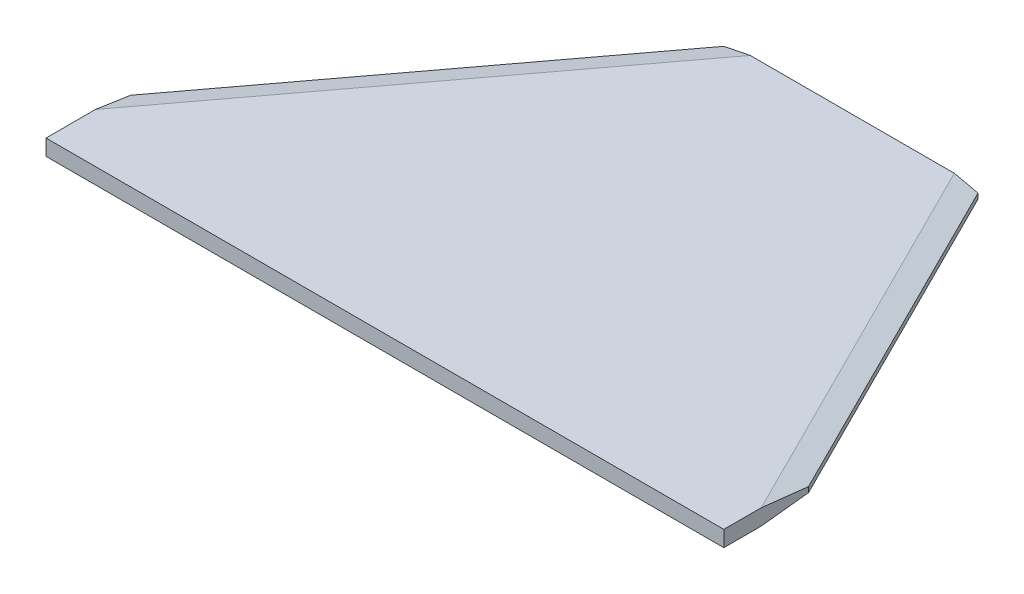
from build123d import *
from OCP.BRepFilletAPI import BRepFilletAPI_MakeChamfer

# Parameters (mm, degrees)
BOSS_EXTRUDE1_DEPTH      = 2.38125
BOSS_EXTRUDE1_DEPTH_BACK = 2.38125
CHAMFER1_SIZE            = 1.5875
CHAMFER1_SIZE2           = 6.35
CHAMFER3_SIZE            = 6.35
CHAMFER3_SIZE2           = 1.5875


with BuildPart() as part:
    # Sketch1 → Boss-Extrude1 (new, two sides: drawn at the far end of the back side and taken through both)
    with BuildSketch(Plane(origin=(0, 0, 0), x_dir=(1, 0, 0), z_dir=(0, 1, 0)).offset(-BOSS_EXTRUDE1_DEPTH_BACK)):
        Polygon((0, 0), (0, 25.4), (76.2, 127), (152.4, 127), (203.2, 25.4), (203.2, 0), align=None)
    extrude(amount=BOSS_EXTRUDE1_DEPTH + BOSS_EXTRUDE1_DEPTH_BACK)

    # Chamfer1: one chamfer whose edges measure the first distance from different faces: ONE call of the kernel's chamfer builder (chamfer() names one face for all edges)
    chamfer1_edges_1 = [part.edges().sort_by_distance(p)[0] for p in [
        (177.8, 2.38125, -76.2),
        (177.8, -2.38125, -76.2),
    ]]
    chamfer1_side_1 = [part.faces().sort_by_distance(p)[0] for p in [
        (177.8, 0, -76.2),
    ]]
    chamfer1_edges_2 = [part.edges().sort_by_distance(p)[0] for p in [
        (38.1, -2.38125, -76.2),
    ]]
    chamfer1_side_2 = [part.faces().sort_by_distance(p)[0] for p in [
        (38.1, 0, -76.2),
    ]]
    chamfer1 = BRepFilletAPI_MakeChamfer(part.part.solid().wrapped)
    for e in chamfer1_edges_1:
        chamfer1.Add(CHAMFER1_SIZE, CHAMFER1_SIZE2, e.wrapped, chamfer1_side_1[0].wrapped)  # the first distance lies on this face
    for e in chamfer1_edges_2:
        chamfer1.Add(CHAMFER1_SIZE, CHAMFER1_SIZE2, e.wrapped, chamfer1_side_2[0].wrapped)  # the first distance lies on this face
    add(Compound.cast(chamfer1.Shape()), mode=Mode.REPLACE)

    # Chamfer3
    chamfer3_edges = [part.edges().sort_by_distance(p)[0] for p in [
        (38.1, 2.38125, -76.2),
    ]]
    chamfer3_side = [part.faces().sort_by_distance(p)[0] for p in [
        (102.626088035, 2.38125, -52.835240535),
    ]]
    chamfer(chamfer3_edges, length=CHAMFER3_SIZE, length2=CHAMFER3_SIZE2, reference=chamfer3_side[0])


solid = part.part
